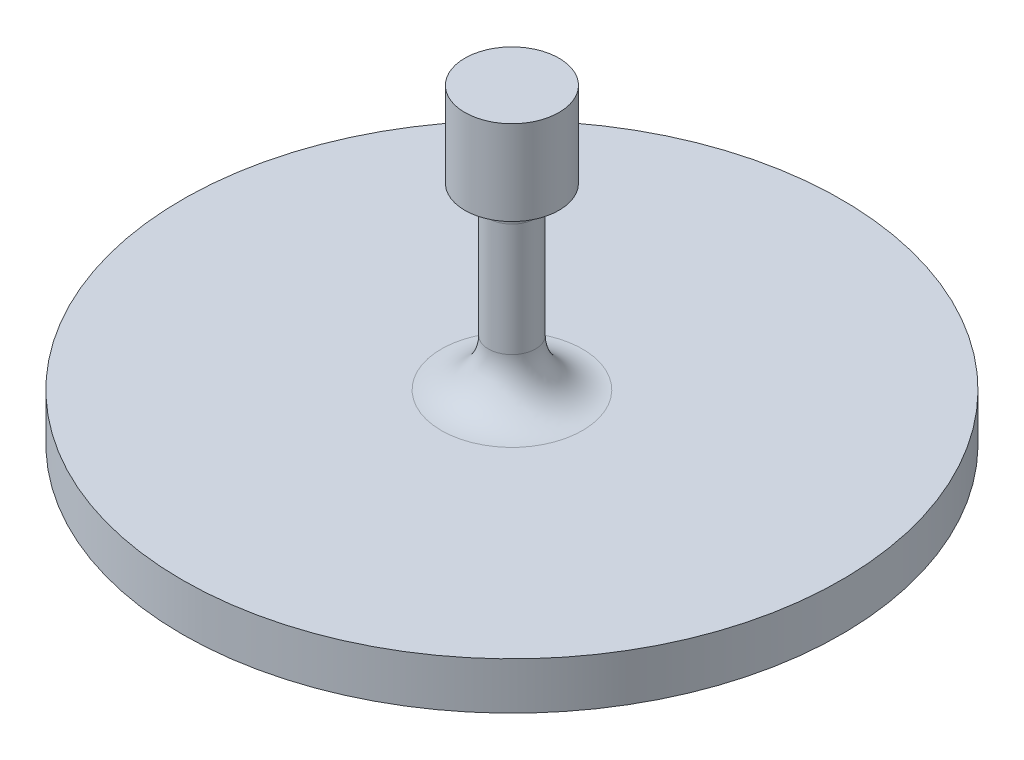
from build123d import *

# Parameters (mm, degrees)
SKETCH_1_R      = 35
EXTRUDE_1_DEPTH = 5
SKETCH_2_R      = 2.5
EXTRUDE_2_DEPTH = 19
SKETCH_3_R      = 5
EXTRUDE_3_DEPTH = 9
FILLET_1_R      = 5
FILLET_2_R      = 2


with BuildPart() as part:
    # 草图1 → 凸台-拉伸1 (new body)
    with BuildSketch(Plane(origin=(0, 0, 0), x_dir=(1, 0, 0), z_dir=(0, 1, 0))):
        with Locations(Location((0, 0, 0), (0, 0, 270))):
            Circle(SKETCH_1_R)
    extrude(amount=EXTRUDE_1_DEPTH)

    # 草图2 → 凸台-拉伸2 (add)
    with BuildSketch(Plane(origin=(0, 5, 0), x_dir=(1, 0, 0), z_dir=(0, 1, 0))):
        with Locations(Location((0, 0, 0), (0, 0, 270))):
            Circle(SKETCH_2_R)
    extrude(amount=EXTRUDE_2_DEPTH)

    # 草图3 → 凸台-拉伸3 (add)
    with BuildSketch(Plane(origin=(0, 24, 0), x_dir=(1, 0, 0), z_dir=(0, 1, 0))):
        with Locations(Location((0, 0, 0), (0, 0, 270))):
            Circle(SKETCH_3_R)
    extrude(amount=EXTRUDE_3_DEPTH)

    # 圆角1
    fillet_1_edges = [part.edges().sort_by_distance(p)[0] for p in [
        (0, 5, -2.5),
    ]]
    fillet(fillet_1_edges, radius=FILLET_1_R)

    # 圆角2
    fillet_2_edges = [part.edges().sort_by_distance(p)[0] for p in [
        (0, 24, -2.5),
    ]]
    fillet(fillet_2_edges, radius=FILLET_2_R)


solid = part.part
